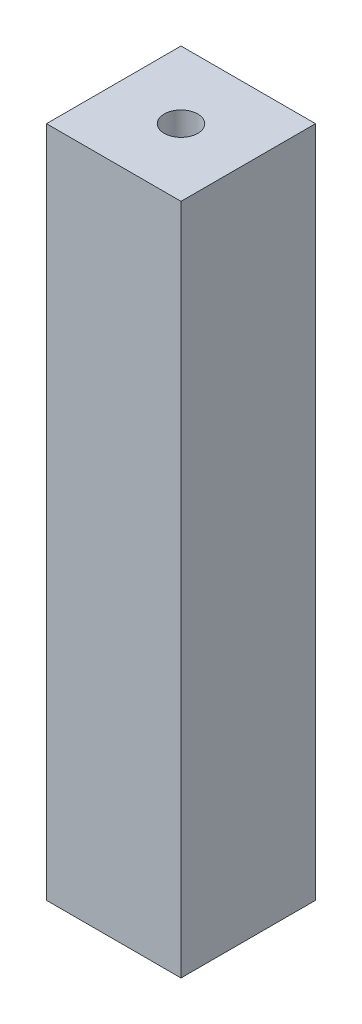
from build123d import *

# Parameters (mm, degrees)
SKETCH1_W           = 20
SKETCH1_H           = 20
BOSS_EXTRUDE1_DEPTH = 100
SKETCH2_R           = 2.5
CUT_EXTRUDE1_DEPTH  = 104


with BuildPart() as part:
    # Sketch1 → Boss-Extrude1 (new body)
    with BuildSketch(Plane(origin=(0, 0, 0), x_dir=(1, 0, 0), z_dir=(0, 1, 0))):
        Rectangle(SKETCH1_W, SKETCH1_H)
    extrude(amount=BOSS_EXTRUDE1_DEPTH)

    # Sketch2 → Cut-Extrude1 (cut)
    with BuildSketch(Plane(origin=(0, 100, 0), x_dir=(1, 0, 0), z_dir=(0, 1, 0))):
        with Locations(Location((0, 0, 0), (0, 0, 270))):
            Circle(SKETCH2_R)
    extrude(amount=-CUT_EXTRUDE1_DEPTH, mode=Mode.SUBTRACT)


solid = part.part
